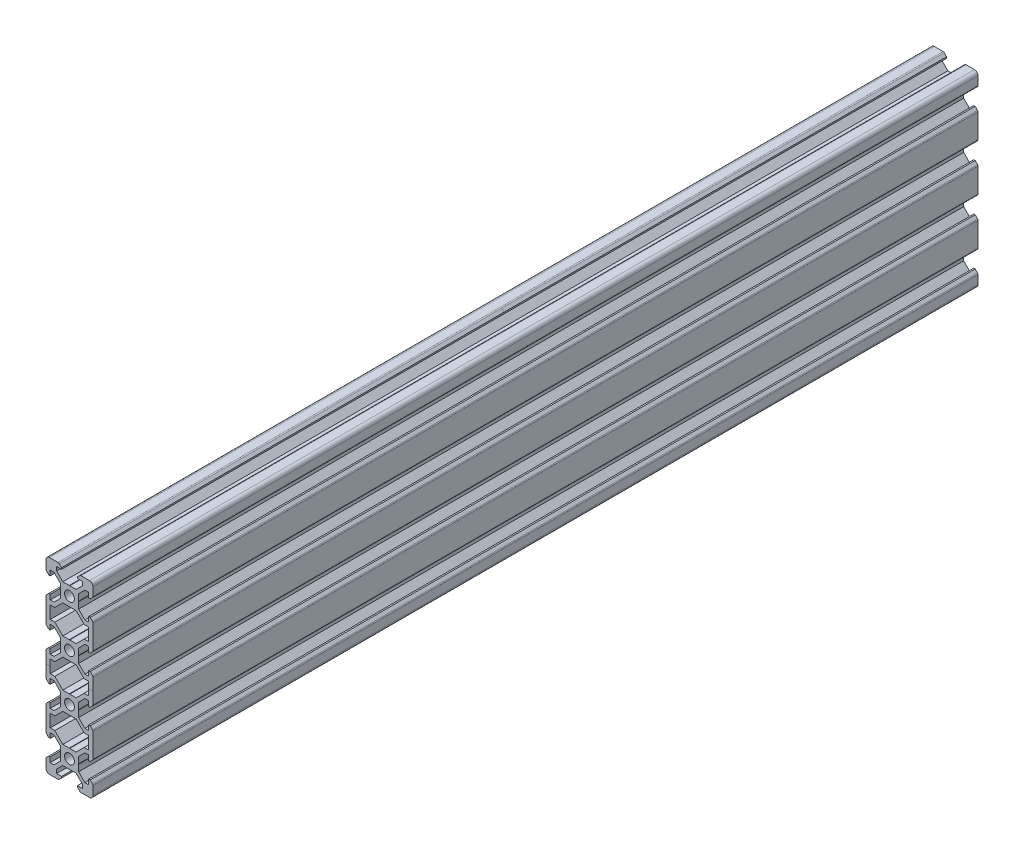
from build123d import *

# Parameters (mm, degrees)
SKETCH1_R           = 2.1
BOSS_EXTRUDE2_DEPTH = 377


with BuildPart() as part:
    # Sketch1 → Boss-Extrude2 (new body)
    with BuildSketch(Plane.XY):
        with BuildLine():
            Line((-8.5, 10), (-4.862792737, 10))
            ThreePointArc((-4.862792737, 10), (-4.598292737, 9.947387679), (-4.374060464, 9.797560464))
            Line((-4.374060464, 9.797560464), (-3.3865, 8.81))
            Line((-3.3865, 8.81), (-3.3865, 8.2))
            Line((-3.3865, 8.2), (-5.5, 8.2))
            Line((-5.5, 8.2), (-5.5, 6.561))
            Line((-5.5, 6.561), (-2.8395, 3.9005))
            Line((-2.8395, 3.9005), (-0.1, 3.9005))
            Line((-0.1, 3.9005), (0, 3.8005))
            Line((0, 3.8005), (0.1, 3.9005))
            Line((0.1, 3.9005), (2.8395, 3.9005))
            Line((2.8395, 3.9005), (5.5, 6.561))
            Line((5.5, 6.561), (5.5, 8.2))
            Line((5.5, 8.2), (3.3865, 8.2))
            Line((3.3865, 8.2), (3.3865, 8.81))
            Line((3.3865, 8.81), (4.374060464, 9.797560464))
            ThreePointArc((4.374060464, 9.797560464), (4.598292737, 9.947387679), (4.862792737, 10))
            Line((4.862792737, 10), (8.5, 10))
            ThreePointArc((8.5, 10), (9.560660172, 9.560660172), (10, 8.5))
            Line((10, 8.5), (10, 4.862792737))
            ThreePointArc((10, 4.862792737), (9.947387679, 4.598292737), (9.797560464, 4.374060464))
            Line((9.797560464, 4.374060464), (8.81, 3.3865))
            Line((8.81, 3.3865), (8.2, 3.3865))
            Line((8.2, 3.3865), (8.2, 5.5))
            Line((8.2, 5.5), (6.561, 5.5))
            Line((6.561, 5.5), (3.9005, 2.8395))
            Line((3.9005, 2.8395), (3.9005, 0.1))
            Line((3.9005, 0.1), (3.8005, 0))
            Line((3.8005, 0), (3.9005, -0.1))
            Line((3.9005, -0.1), (3.9005, -2.8395))
            Line((3.9005, -2.8395), (6.561, -5.5))
            Line((6.561, -5.5), (8.2, -5.5))
            Line((8.2, -5.5), (8.2, -3.3865))
            Line((8.2, -3.3865), (8.81, -3.3865))
            Line((8.81, -3.3865), (9.797560464, -4.374060464))
            ThreePointArc((9.797560464, -4.374060464), (9.947387679, -4.598292737), (10, -4.862792737))
            Line((10, -4.862792737), (10, -15.137207263))
            ThreePointArc((10, -15.137207263), (9.947387679, -15.401707263), (9.797560464, -15.625939536))
            Line((9.797560464, -15.625939536), (8.81, -16.6135))
            Line((8.81, -16.6135), (8.2, -16.6135))
            Line((8.2, -16.6135), (8.2, -14.5))
            Line((8.2, -14.5), (6.561, -14.5))
            Line((6.561, -14.5), (3.9005, -17.1605))
            Line((3.9005, -17.1605), (3.9005, -19.9))
            Line((3.9005, -19.9), (3.8005, -20))
            Line((3.8005, -20), (3.9005, -20.1))
            Line((3.9005, -20.1), (3.9005, -22.8395))
            Line((3.9005, -22.8395), (6.561, -25.5))
            Line((6.561, -25.5), (8.2, -25.5))
            Line((8.2, -25.5), (8.2, -23.3865))
            Line((8.2, -23.3865), (8.81, -23.3865))
            Line((8.81, -23.3865), (9.797560464, -24.374060464))
            ThreePointArc((9.797560464, -24.374060464), (9.947387679, -24.598292737), (10, -24.862792737))
            Line((10, -24.862792737), (10, -35.137207263))
            ThreePointArc((10, -35.137207263), (9.947387679, -35.401707263), (9.797560464, -35.625939536))
            Line((9.797560464, -35.625939536), (8.81, -36.6135))
            Line((8.81, -36.6135), (8.2, -36.6135))
            Line((8.2, -36.6135), (8.2, -34.5))
            Line((8.2, -34.5), (6.561, -34.5))
            Line((6.561, -34.5), (3.9005, -37.1605))
            Line((3.9005, -37.1605), (3.9005, -39.9))
            Line((3.9005, -39.9), (3.8005, -40))
            Line((3.8005, -40), (3.9005, -40.1))
            Line((3.9005, -40.1), (3.9005, -42.8395))
            Line((3.9005, -42.8395), (6.561, -45.5))
            Line((6.561, -45.5), (8.2, -45.5))
            Line((8.2, -45.5), (8.2, -43.3865))
            Line((8.2, -43.3865), (8.81, -43.3865))
            Line((8.81, -43.3865), (9.797560464, -44.374060464))
            ThreePointArc((9.797560464, -44.374060464), (9.947387679, -44.598292737), (10, -44.862792737))
            Line((10, -44.862792737), (10, -55.137207263))
            ThreePointArc((10, -55.137207263), (9.947387679, -55.401707263), (9.797560464, -55.625939536))
            Line((9.797560464, -55.625939536), (8.81, -56.6135))
            Line((8.81, -56.6135), (8.2, -56.6135))
            Line((8.2, -56.6135), (8.2, -54.5))
            Line((8.2, -54.5), (6.561, -54.5))
            Line((6.561, -54.5), (3.9005, -57.1605))
            Line((3.9005, -57.1605), (3.9005, -59.9))
            Line((3.9005, -59.9), (3.8005, -60))
            Line((3.8005, -60), (3.9005, -60.1))
            Line((3.9005, -60.1), (3.9005, -62.8395))
            Line((3.9005, -62.8395), (6.561, -65.5))
            Line((6.561, -65.5), (8.2, -65.5))
            Line((8.2, -65.5), (8.2, -63.3865))
            Line((8.2, -63.3865), (8.81, -63.3865))
            Line((8.81, -63.3865), (9.797560464, -64.374060464))
            ThreePointArc((9.797560464, -64.374060464), (9.947387679, -64.598292737), (10, -64.862792737))
            Line((10, -64.862792737), (10, -68.5))
            ThreePointArc((10, -68.5), (9.560660172, -69.560660172), (8.5, -70))
            Line((8.5, -70), (4.862792737, -70))
            ThreePointArc((4.862792737, -70), (4.598292737, -69.947387679), (4.374060464, -69.797560464))
            Line((4.374060464, -69.797560464), (3.3865, -68.81))
            Line((3.3865, -68.81), (3.3865, -68.2))
            Line((3.3865, -68.2), (5.5, -68.2))
            Line((5.5, -68.2), (5.5, -66.561))
            Line((5.5, -66.561), (2.8395, -63.9005))
            Line((2.8395, -63.9005), (0.1, -63.9005))
            Line((0.1, -63.9005), (0, -63.8005))
            Line((0, -63.8005), (-0.1, -63.9005))
            Line((-0.1, -63.9005), (-2.8395, -63.9005))
            Line((-2.8395, -63.9005), (-5.5, -66.561))
            Line((-5.5, -66.561), (-5.5, -68.2))
            Line((-5.5, -68.2), (-3.3865, -68.2))
            Line((-3.3865, -68.2), (-3.3865, -68.81))
            Line((-3.3865, -68.81), (-4.374060464, -69.797560464))
            ThreePointArc((-4.374060464, -69.797560464), (-4.598292737, -69.947387679), (-4.862792737, -70))
            Line((-4.862792737, -70), (-8.5, -70))
            ThreePointArc((-8.5, -70), (-9.560660172, -69.560660172), (-10, -68.5))
            Line((-10, -68.5), (-10, -64.862792737))
            ThreePointArc((-10, -64.862792737), (-9.947387679, -64.598292737), (-9.797560464, -64.374060464))
            Line((-9.797560464, -64.374060464), (-8.81, -63.3865))
            Line((-8.81, -63.3865), (-8.2, -63.3865))
            Line((-8.2, -63.3865), (-8.2, -65.5))
            Line((-8.2, -65.5), (-6.561, -65.5))
            Line((-6.561, -65.5), (-3.9005, -62.8395))
            Line((-3.9005, -62.8395), (-3.9005, -60.1))
            Line((-3.9005, -60.1), (-3.8005, -60))
            Line((-3.8005, -60), (-3.9005, -59.9))
            Line((-3.9005, -59.9), (-3.9005, -57.1605))
            Line((-3.9005, -57.1605), (-6.561, -54.5))
            Line((-6.561, -54.5), (-8.2, -54.5))
            Line((-8.2, -54.5), (-8.2, -56.6135))
            Line((-8.2, -56.6135), (-8.81, -56.6135))
            Line((-8.81, -56.6135), (-9.797560464, -55.625939536))
            ThreePointArc((-9.797560464, -55.625939536), (-9.947387679, -55.401707263), (-10, -55.137207263))
            Line((-10, -55.137207263), (-10, -44.862792737))
            ThreePointArc((-10, -44.862792737), (-9.947387679, -44.598292737), (-9.797560464, -44.374060464))
            Line((-9.797560464, -44.374060464), (-8.81, -43.3865))
            Line((-8.81, -43.3865), (-8.2, -43.3865))
            Line((-8.2, -43.3865), (-8.2, -45.5))
            Line((-8.2, -45.5), (-6.561, -45.5))
            Line((-6.561, -45.5), (-3.9005, -42.8395))
            Line((-3.9005, -42.8395), (-3.9005, -40.1))
            Line((-3.9005, -40.1), (-3.8005, -40))
            Line((-3.8005, -40), (-3.9005, -39.9))
            Line((-3.9005, -39.9), (-3.9005, -37.1605))
            Line((-3.9005, -37.1605), (-6.561, -34.5))
            Line((-6.561, -34.5), (-8.2, -34.5))
            Line((-8.2, -34.5), (-8.2, -36.6135))
            Line((-8.2, -36.6135), (-8.81, -36.6135))
            Line((-8.81, -36.6135), (-9.797560464, -35.625939536))
            ThreePointArc((-9.797560464, -35.625939536), (-9.947387679, -35.401707263), (-10, -35.137207263))
            Line((-10, -35.137207263), (-10, -24.862792737))
            ThreePointArc((-10, -24.862792737), (-9.947387679, -24.598292737), (-9.797560464, -24.374060464))
            Line((-9.797560464, -24.374060464), (-8.81, -23.3865))
            Line((-8.81, -23.3865), (-8.2, -23.3865))
            Line((-8.2, -23.3865), (-8.2, -25.5))
            Line((-8.2, -25.5), (-6.561, -25.5))
            Line((-6.561, -25.5), (-3.9005, -22.8395))
            Line((-3.9005, -22.8395), (-3.9005, -20.1))
            Line((-3.9005, -20.1), (-3.8005, -20))
            Line((-3.8005, -20), (-3.9005, -19.9))
            Line((-3.9005, -19.9), (-3.9005, -17.1605))
            Line((-3.9005, -17.1605), (-6.561, -14.5))
            Line((-6.561, -14.5), (-8.2, -14.5))
            Line((-8.2, -14.5), (-8.2, -16.6135))
            Line((-8.2, -16.6135), (-8.81, -16.6135))
            Line((-8.81, -16.6135), (-9.797560464, -15.625939536))
            ThreePointArc((-9.797560464, -15.625939536), (-9.947387679, -15.401707263), (-10, -15.137207263))
            Line((-10, -15.137207263), (-10, -4.862792737))
            ThreePointArc((-10, -4.862792737), (-9.947387679, -4.598292737), (-9.797560464, -4.374060464))
            Line((-9.797560464, -4.374060464), (-8.81, -3.3865))
            Line((-8.81, -3.3865), (-8.2, -3.3865))
            Line((-8.2, -3.3865), (-8.2, -5.5))
            Line((-8.2, -5.5), (-6.561, -5.5))
            Line((-6.561, -5.5), (-3.9005, -2.8395))
            Line((-3.9005, -2.8395), (-3.9005, -0.1))
            Line((-3.9005, -0.1), (-3.8005, 0))
            Line((-3.8005, 0), (-3.9005, 0.1))
            Line((-3.9005, 0.1), (-3.9005, 2.8395))
            Line((-3.9005, 2.8395), (-6.561, 5.5))
            Line((-6.561, 5.5), (-8.2, 5.5))
            Line((-8.2, 5.5), (-8.2, 3.3865))
            Line((-8.2, 3.3865), (-8.81, 3.3865))
            Line((-8.81, 3.3865), (-9.797560464, 4.374060464))
            ThreePointArc((-9.797560464, 4.374060464), (-9.947387679, 4.598292737), (-10, 4.862792737))
            Line((-10, 4.862792737), (-10, 8.5))
            ThreePointArc((-10, 8.5), (-9.560660172, 9.560660172), (-8.5, 10))
        make_face()
        Circle(SKETCH1_R, mode=Mode.SUBTRACT)
        with Locations((0, -20)):
            Circle(SKETCH1_R, mode=Mode.SUBTRACT)
        with Locations(Location((0, -40, 0), (0, 0, 180))):
            Circle(SKETCH1_R, mode=Mode.SUBTRACT)
        with Locations(Location((0, -60, 0), (0, 0, 180))):
            Circle(SKETCH1_R, mode=Mode.SUBTRACT)
        Polygon((-8.2, -12.7), (-8.2, -7.3), (-6.239, -7.3), (-5.5, -6.561), (-2.8395, -3.9005), (-0.1, -3.9005), (0, -3.8005), (0.1, -3.9005), (2.8395, -3.9005), (5.5, -6.561), (6.239, -7.3), (8.2, -7.3), (8.2, -12.7), (6.239, -12.7), (5.5, -13.439), (2.8395, -16.0995), (0.1, -16.0995), (0, -16.1995), (-0.1, -16.0995), (-2.8395, -16.0995), (-5.5, -13.439), (-6.239, -12.7), align=None, mode=Mode.SUBTRACT)
        Polygon((2.8395, -23.9005), (5.5, -26.561), (6.239, -27.3), (8.2, -27.3), (8.2, -32.7), (6.239, -32.7), (5.5, -33.439), (2.8395, -36.0995), (0.1, -36.0995), (0, -36.1995), (-0.1, -36.0995), (-2.8395, -36.0995), (-5.5, -33.439), (-6.239, -32.7), (-8.2, -32.7), (-8.2, -27.3), (-6.239, -27.3), (-5.5, -26.561), (-2.8395, -23.9005), (-0.1, -23.9005), (0, -23.8005), (0.1, -23.9005), align=None, mode=Mode.SUBTRACT)
        Polygon((-0.1, -56.0995), (0, -56.1995), (0.1, -56.0995), (2.8395, -56.0995), (5.5, -53.439), (6.239, -52.7), (8.2, -52.7), (8.2, -47.3), (6.239, -47.3), (5.5, -46.561), (2.8395, -43.9005), (0.1, -43.9005), (0, -43.8005), (-0.1, -43.9005), (-2.8395, -43.9005), (-5.5, -46.561), (-6.239, -47.3), (-8.2, -47.3), (-8.2, -52.7), (-6.239, -52.7), (-5.5, -53.439), (-2.8395, -56.0995), align=None, mode=Mode.SUBTRACT)
    extrude(amount=BOSS_EXTRUDE2_DEPTH)


solid = part.part
